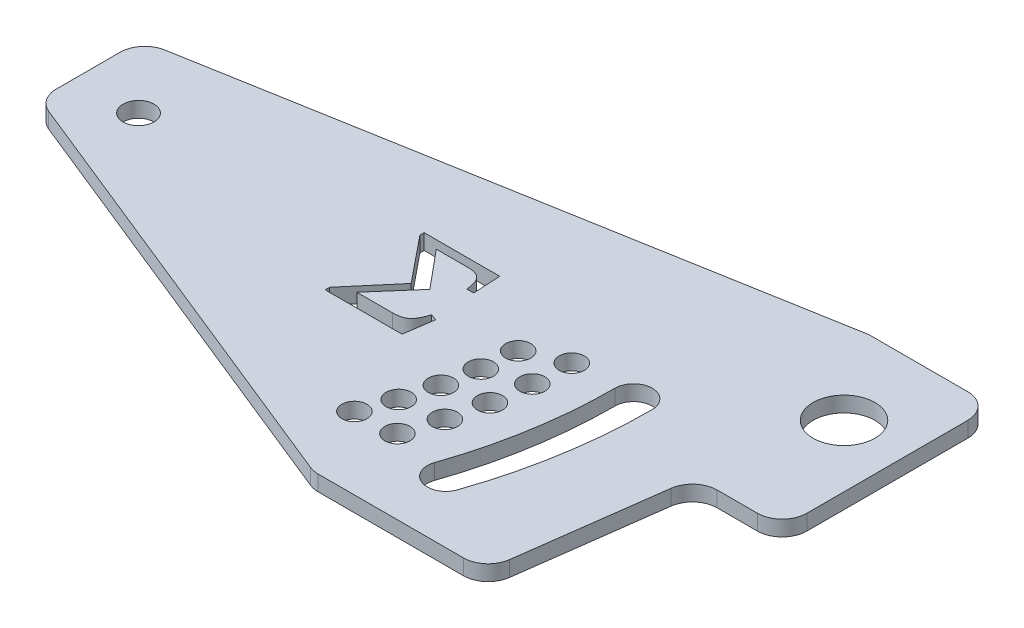
from build123d import *

# Parameters (mm, degrees)
SKETCH1_W           = 152.4
SKETCH1_H           = 81.28
BOSS_EXTRUDE1_DEPTH = 3.175
SKETCH2_R           = 3.175
SKETCH2_R_2         = 6.35
CUT_EXTRUDE1_DEPTH  = 173.74917952
CHAMFER1_SIZE       = 38.1
CHAMFER1_SIZE2      = 94.300809115
CHAMFER2_SIZE       = 127
CHAMFER2_SIZE2      = 22.39352655
CUT_EXTRUDE2_DEPTH  = 173.74917952
FILLET1_R           = 5.08
CUT_EXTRUDE3_DEPTH  = 173.74917952
SKETCH5_R           = 2.5796875
CUT_EXTRUDE4_DEPTH  = 173.749179658
CIRPATTERN1_COUNT   = 5
CIRPATTERN1_ANGLE   = 20


with BuildPart() as part:
    # Sketch1 → Boss-Extrude1 (new body)
    with BuildSketch(Plane(origin=(0, 0, 0), x_dir=(1, 0, 0), z_dir=(0, 1, 0))):
        with Locations((76.2, 40.64)):
            Rectangle(SKETCH1_W, SKETCH1_H)
    extrude(amount=BOSS_EXTRUDE1_DEPTH)

    # Sketch2 → Cut-Extrude1 (cut, through all)
    with BuildSketch(Plane(origin=(0, 3.175, 0), x_dir=(1, 0, 0), z_dir=(0, 1, 0))):
        with Locations(Location((12.7, 45.72, 0), (0, 0, 270))):
            Circle(SKETCH2_R)
        with Locations(Location((139.7, 63.5, 0), (0, 0, 270))):
            Circle(SKETCH2_R_2)
        with BuildLine():
            ThreePointArc((118.11, 45.72), (114.3, 49.53), (110.49, 45.72))
            ThreePointArc((110.49, 45.72), (109.15371332, 29.608970028), (105.181373622, 13.93825))
            ThreePointArc((105.181373622, 13.93825), (107.546294022, 9.096829599), (112.387714423, 11.46175))
            ThreePointArc((112.387714423, 11.46175), (116.669587085, 28.353565095), (118.11, 45.72))
        make_face()
    extrude(amount=-CUT_EXTRUDE1_DEPTH, mode=Mode.SUBTRACT)

    # Chamfer1
    chamfer1_edges = [part.edges().sort_by_distance(p)[0] for p in [
        (0, 1.5875, 0),
    ]]
    chamfer1_side = [part.faces().sort_by_distance(p)[0] for p in [
        (0, 1.5875, -40.64),
    ]]
    chamfer(chamfer1_edges, length=CHAMFER1_SIZE, length2=CHAMFER1_SIZE2, reference=chamfer1_side[0])

    # Chamfer2
    chamfer2_edges = [part.edges().sort_by_distance(p)[0] for p in [
        (0, 1.5875, -81.28),
    ]]
    chamfer2_side = [part.faces().sort_by_distance(p)[0] for p in [
        (76.2, 1.5875, -81.28),
    ]]
    chamfer(chamfer2_edges, length=CHAMFER2_SIZE, length2=CHAMFER2_SIZE2, reference=chamfer2_side[0])

    # Sketch3 → Cut-Extrude2 (cut, through all)
    with BuildSketch(Plane(origin=(0, 3.175, 0), x_dir=(1, 0, 0), z_dir=(0, 1, 0))):
        Polygon((134.62, 38.1), (129.54, 0), (152.4, 0), (152.4, 38.1), align=None)
    extrude(amount=-CUT_EXTRUDE2_DEPTH, mode=Mode.SUBTRACT)

    # Fillet1
    fillet1_edges = [part.edges().sort_by_distance(p)[0] for p in [
        (94.300809115, 1.5875, 0),
        (0, 1.5875, -38.1),
        (0, 1.5875, -58.88647345),
        (127, 1.5875, -81.28),
        (152.4, 1.5875, -38.1),
        (129.54, 1.5875, 0),
        (134.62, 1.5875, -38.1),
        (152.4, 1.5875, -81.28),
    ]]
    fillet(fillet1_edges, radius=FILLET1_R)

    # Sketch4 → Cut-Extrude3 (cut, through all)
    with BuildSketch(Plane(origin=(0, 3.175, 0), x_dir=(1, 0, 0), z_dir=(0, 1, 0))):
        with BuildLine():
            Line((79.02824603, 33.454322708), (63.267898808, 33.454322708))
            Line((63.267898808, 33.454322708), (63.267898808, 34.367135208))
            Line((63.267898808, 34.367135208), (70.958454364, 43.415885208))
            Line((70.958454364, 43.415885208), (63.267898808, 52.892378263))
            Line((63.267898808, 52.892378263), (63.267898808, 53.774322708))
            Line((63.267898808, 53.774322708), (78.768072419, 53.774322708))
            Line((78.768072419, 53.774322708), (79.072343253, 48.129878263))
            Line((79.072343253, 48.129878263), (77.687690475, 48.129878263))
            add(Edge.make_bspline(
                [(77.687690475, 48.129878263), (77.666267335, 48.312443932), (77.624982011, 48.664272977), (77.531920072, 49.166102178), (77.421008935, 49.62371596), (77.297338484, 50.038468153), (77.145364304, 50.406140244), (76.981241456, 50.731622206), (76.788125584, 51.007791949), (76.57914231, 51.245843364), (76.346452552, 51.448106373), (76.086781148, 51.614145073), (75.807782072, 51.761949969), (75.502009403, 51.881996436), (75.169445928, 51.96657961), (74.814820872, 52.034378559), (74.435667298, 52.073714003), (74.174700115, 52.078522896), (74.040850197, 52.080989374)],
                knots=[0, 0, 0, 0, 1.445989141, 2.78661909, 4.012434194, 5.150135165, 6.187474348, 7.139280037, 8.011906442, 8.831168962, 9.626489899, 10.428426412, 11.250947746, 12.10787495, 13.005585407, 13.946934481, 14.94698387, 16, 16, 16, 16], degree=3))
            Line((74.040850197, 52.080989374), (67.43949603, 52.080989374))
            Line((67.43949603, 52.080989374), (73.921787697, 44.280190763))
            Line((73.921787697, 44.280190763), (66.950016864, 36.27654493))
            Line((66.950016864, 36.27654493), (74.212829364, 36.27654493))
            add(Edge.make_bspline(
                [(74.212829364, 36.27654493), (74.36279346, 36.279802671), (74.654213785, 36.286133332), (75.077264171, 36.314305601), (75.470658519, 36.371763784), (75.832477573, 36.452086018), (76.16654489, 36.545672831), (76.468216936, 36.671559846), (76.742753798, 36.815646486), (76.99291299, 36.987221798), (77.223304318, 37.196939313), (77.442312889, 37.449316269), (77.65608094, 37.749183515), (77.859903069, 38.097852765), (78.063918522, 38.491956646), (78.259688528, 38.933240259), (78.457090359, 39.41997208), (78.571649199, 39.765370609), (78.63137103, 39.945433819)],
                knots=[0, 0, 0, 0, 1.136055194, 2.207658906, 3.209008574, 4.143648749, 5.013803629, 5.832513146, 6.614441668, 7.358687952, 8.123305807, 8.967432535, 9.885009082, 10.908395979, 12.023751854, 13.244578613, 14.563543328, 16, 16, 16, 16], degree=3))
            Line((78.63137103, 39.945433819), (79.919009919, 39.469183819))
            Line((79.919009919, 39.469183819), (79.02824603, 33.454322708))
        make_face()
    extrude(amount=-CUT_EXTRUDE3_DEPTH, mode=Mode.SUBTRACT)

    # Sketch5 → Cut-Extrude4 (cut, through all)
    with BuildSketch(Plane(origin=(0, 3.175, 0), x_dir=(1, 0, 0), z_dir=(0, 1, 0))):
        with Locations(Location((101.6, 45.72, 0), (0, 0, 270))):
            Circle(SKETCH5_R)
        with Locations(Location((93.912900428, 42.418, 0), (0, 0, 270))):
            Circle(SKETCH5_R)
    cut_extrude4 = extrude(amount=-CUT_EXTRUDE4_DEPTH, mode=Mode.SUBTRACT)

    # CirPattern1: Cut-Extrude4 ×5 about axis
    cirpattern1_axis = Axis((12.7, 0, -45.72), (0, -1, 0))
    for i in range(1, CIRPATTERN1_COUNT):
        add(cut_extrude4.rotate(cirpattern1_axis, i * CIRPATTERN1_ANGLE / (CIRPATTERN1_COUNT - 1)), mode=Mode.SUBTRACT)


solid = part.part
